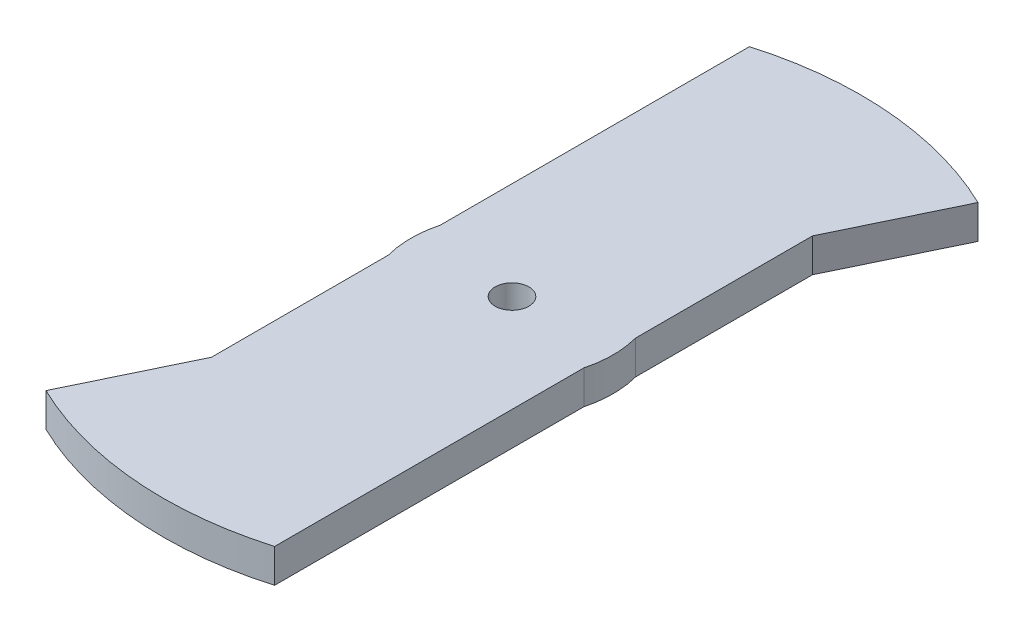
from build123d import *

# Parameters (mm, degrees)
SKETCH1_R           = 3.175
BOSS_EXTRUDE1_DEPTH = 6.35


with BuildPart() as part:
    # Sketch1 → Boss-Extrude1 (new body)
    with BuildSketch(Plane(origin=(0, 0, 0), x_dir=(1, 0, 0), z_dir=(0, 1, 0))):
        with BuildLine():
            ThreePointArc((18.415, 4.87752755), (19.05, 0), (18.415, -4.87752755))
            Line((18.415, -4.87752755), (18.415, -63.156041445))
            ThreePointArc((18.415, -63.156041445), (-5.43300968, -65.561270593), (-28.559790419, -59.263278404))
            Line((-28.559790419, -59.263278404), (-18.415, -38.212229705))
            Line((-18.415, -38.212229705), (-18.415, -4.87752755))
            ThreePointArc((-18.415, -4.87752755), (-19.05, 0), (-18.415, 4.87752755))
            Line((-18.415, 4.87752755), (-18.415, 63.156041445))
            ThreePointArc((-18.415, 63.156041445), (5.43300968, 65.561270593), (28.559790419, 59.263278404))
            Line((28.559790419, 59.263278404), (18.415, 38.212229705))
            Line((18.415, 38.212229705), (18.415, 4.87752755))
        make_face()
        with Locations(Location((0, 0, 0), (0, 0, 270))):
            Circle(SKETCH1_R, mode=Mode.SUBTRACT)
    extrude(amount=BOSS_EXTRUDE1_DEPTH)


solid = part.part
